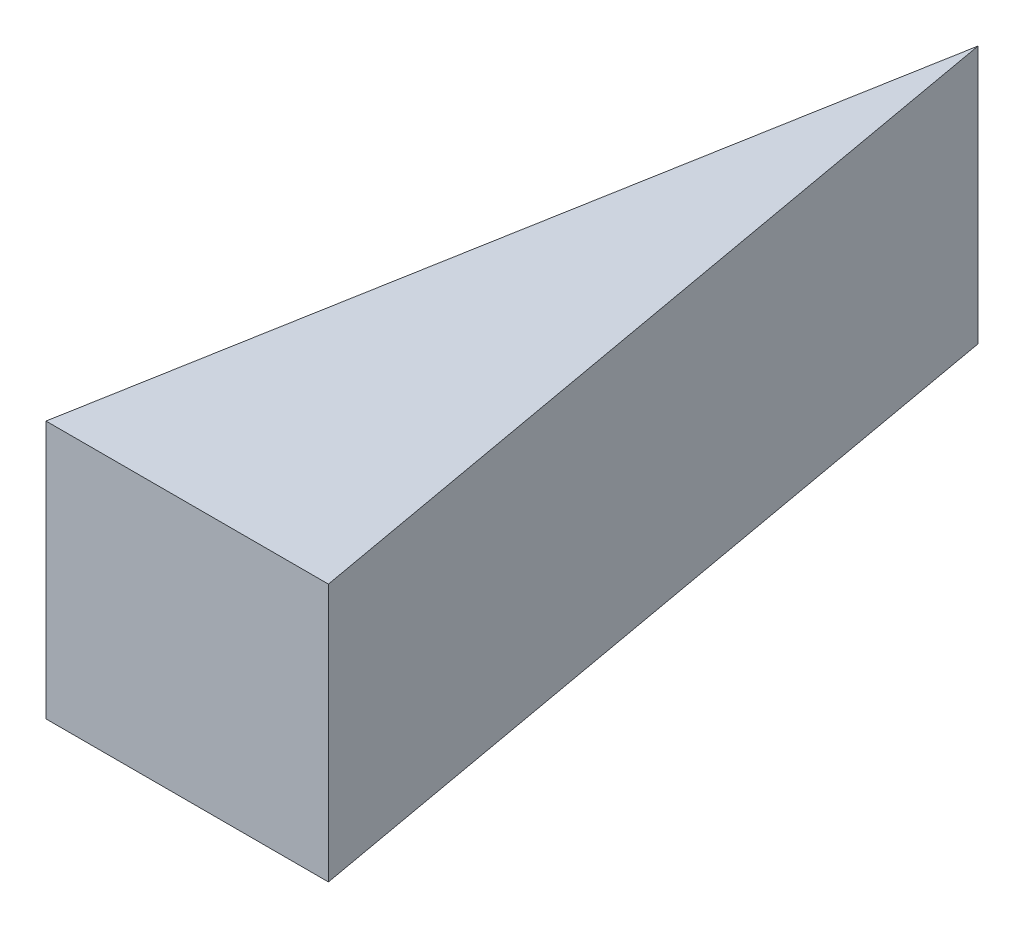
from build123d import *

# Parameters (mm, degrees)
MAIN_BLOCK_EXTRUDE_DEPTH = 65.09
SHELL1_T                 = -5


with BuildPart() as part:
    # Sketch1 → Main block extrude (new, symmetric)
    with BuildSketch(Plane(origin=(0, 0, 0), x_dir=(1, 0, 0), z_dir=(0, 1, 0))):
        Polygon((0, 0), (-71.265, -399.066716446), (71.265, -399.066716446), align=None)
    extrude(amount=MAIN_BLOCK_EXTRUDE_DEPTH, both=True)

    # Shell1
    shell1_openings = [part.faces().sort_by_distance(p)[0] for p in [
        (0, -65.09, 266.044477631),
    ]]
    offset(amount=SHELL1_T, openings=shell1_openings, kind=Kind.INTERSECTION)


solid = part.part
